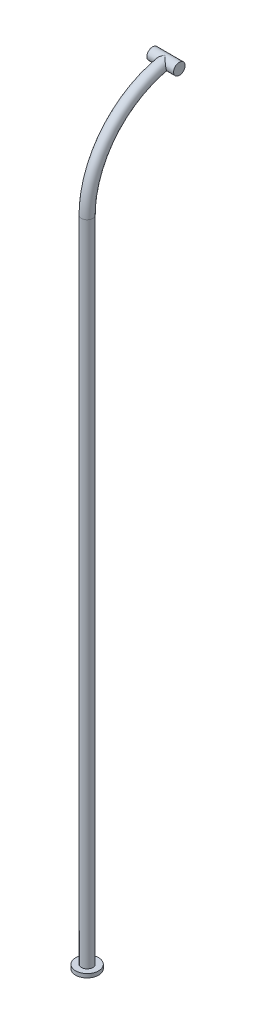
from build123d import *

# Parameters (mm, degrees)
SKETCH1_R                = 1.5
BOSS_EXTRUDE1_DEPTH      = 170
SKETCH4_R                = 3
BOSS_EXTRUDE4_DEPTH      = 1
SKETCH7_R                = 1.5
REVOLVE1_ANGLE           = 80
BOSS_EXTRUDE5_DEPTH      = 3.5
BOSS_EXTRUDE5_DEPTH_BACK = 3.5
SKETCH8_R                = 1.5


with BuildPart() as part:
    # Sketch1 → Boss-Extrude1 (new body)
    with BuildSketch(Plane(origin=(0, 0, 0), x_dir=(1, 0, 0), z_dir=(0, 1, 0))):
        Circle(SKETCH1_R)
    extrude(amount=BOSS_EXTRUDE1_DEPTH)

    # Sketch4 → Boss-Extrude4 (add)
    with BuildSketch(Plane.XZ):
        Circle(SKETCH4_R)
    extrude(amount=BOSS_EXTRUDE4_DEPTH)

    # Sketch7 → Revolve1 (revolve)
    with BuildSketch(Plane(origin=(0, 170, 0), x_dir=(1, 0, 0), z_dir=(0, 1, 0))):
        Circle(SKETCH7_R)
    revolve(axis=Axis((-42.510122648, 170, -25), (-1, 0, 0)), revolution_arc=REVOLVE1_ANGLE)

    # Sketch8 → Boss-Extrude5 (add, two sides: drawn at the far end of the back side and taken through both)
    with BuildSketch(Plane(origin=(0, 0, 0), x_dir=(0, 0, -1), z_dir=(1, 0, 0)).offset(-BOSS_EXTRUDE5_DEPTH_BACK)):
        with Locations((20.658795558, 194.620193825)):
            Circle(SKETCH8_R)
    extrude(amount=BOSS_EXTRUDE5_DEPTH + BOSS_EXTRUDE5_DEPTH_BACK)


solid = part.part
